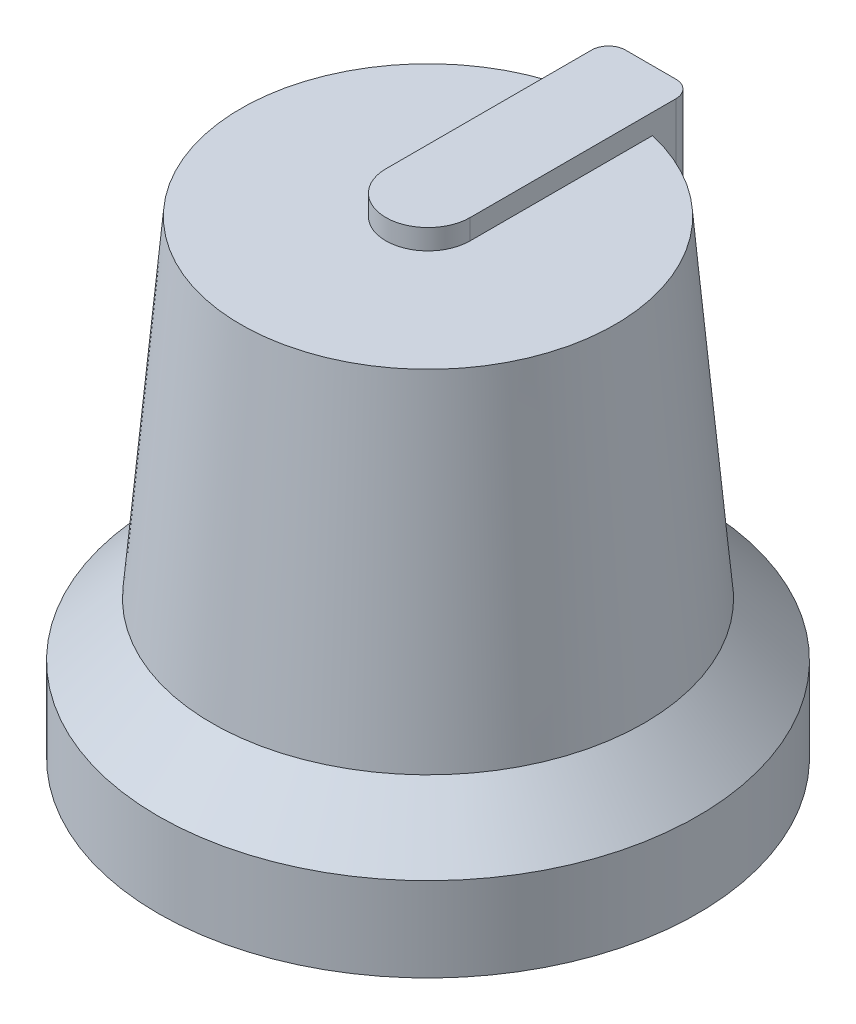
from build123d import *

# Parameters (mm, degrees)
BOSS_EXTRUDE1_REACH             = 19.922
BOSS_EXTRUDE1_DIRECTION_2_DEPTH = 0.6
SKETCH3_R                       = 3
CUT_EXTRUDE1_DEPTH              = 12


with BuildPart() as part:
    # Sketch1 → Revolve1 (revolve)
    with BuildSketch(Plane.XY):
        Polygon((0, 13.9), (5.55, 13.9), (6.408097327, 4.091902673), (8, 2.5), (8, 0), (0, 0), align=None)
    revolve(axis=Axis((0, 0, 0), (0, 1, 0)))

    # Sketch2 → Boss-Extrude1 (add, up to next)
    with BuildSketch(Plane(origin=(0, 13.9, 0), x_dir=(1, 0, 0), z_dir=(0, 1, 0)), mode=Mode.PRIVATE) as boss_extrude1_sk1:
        with BuildLine():
            Line((-1.25000004, 6.104), (-1.25000004, 0))
            ThreePointArc((-1.25000004, 0), (0, -1.25000004), (1.25000004, 0))
            Line((1.25000004, 0), (1.25000004, 6.104))
            ThreePointArc((1.25000004, 6.104), (1.103553431, 6.457553391), (0.75000004, 6.604))
            Line((0.75000004, 6.604), (-0.75000004, 6.604))
            ThreePointArc((-0.75000004, 6.604), (-1.103553431, 6.457553391), (-1.25000004, 6.104))
        make_face()
    boss_extrude1_tool1 = extrude(boss_extrude1_sk1.sketch, amount=-BOSS_EXTRUDE1_REACH, mode=Mode.PRIVATE) - part.part
    add(boss_extrude1_tool1.solids().sort_by_distance((0, 13.9, -2.78502))[0])

    # Sketch2 → Boss-Extrude1 direction 2 (add)
    with BuildSketch(Plane(origin=(0, 13.9, 0), x_dir=(1, 0, 0), z_dir=(0, 1, 0))):
        with BuildLine():
            Line((-1.25000004, 6.104), (-1.25000004, 0))
            ThreePointArc((-1.25000004, 0), (0, -1.25000004), (1.25000004, 0))
            Line((1.25000004, 0), (1.25000004, 6.104))
            ThreePointArc((1.25000004, 6.104), (1.103553431, 6.457553391), (0.75000004, 6.604))
            Line((0.75000004, 6.604), (-0.75000004, 6.604))
            ThreePointArc((-0.75000004, 6.604), (-1.103553431, 6.457553391), (-1.25000004, 6.104))
        make_face()
    extrude(amount=BOSS_EXTRUDE1_DIRECTION_2_DEPTH)

    # Sketch3 → Cut-Extrude1 (cut)
    with BuildSketch(Plane(origin=(0, 0, 0), x_dir=(1, 0, 0), z_dir=(0, 1, 0))):
        Circle(SKETCH3_R)
    extrude(amount=CUT_EXTRUDE1_DEPTH, mode=Mode.SUBTRACT)


solid = part.part
